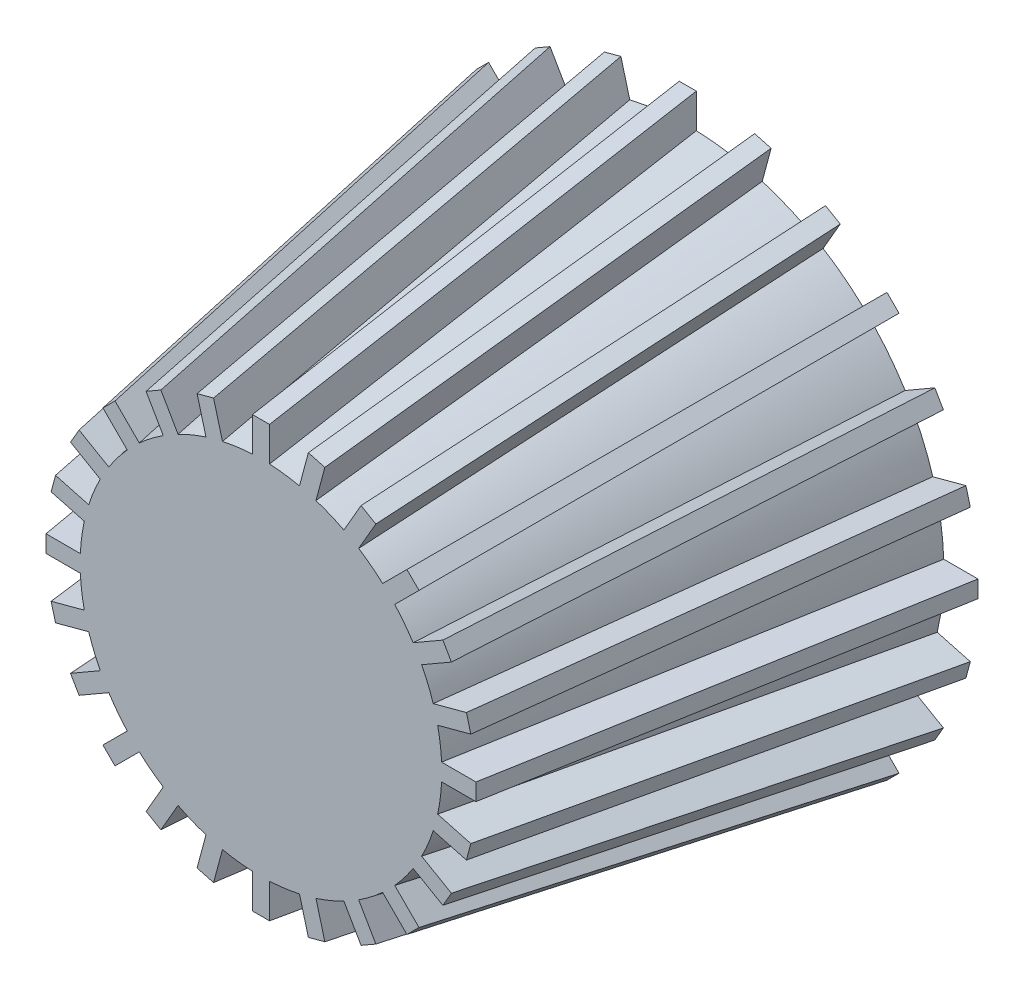
from build123d import *

# Parameters (mm, degrees)
SKETCH1_R           = 30
BOSS_EXTRUDE6_DEPTH = 50
BOSS_EXTRUDE6_TAPER = 10
SKETCH5_R           = 28
CUT_EXTRUDE1_DEPTH  = 50
CUT_EXTRUDE1_TAPER  = 10
SKETCH6_R           = 21.183650965
BOSS_EXTRUDE7_DEPTH = 5
BOSS_EXTRUDE8_DEPTH = 1
CIRPATTERN2_COUNT   = 24


with BuildPart() as part:
    # Sketch1 → Boss-Extrude6 (new body)
    with BuildSketch(Plane.XY):
        Circle(SKETCH1_R)
    extrude(amount=BOSS_EXTRUDE6_DEPTH, taper=BOSS_EXTRUDE6_TAPER)

    # Sketch5 → Cut-Extrude1 (cut)
    with BuildSketch(Plane.XY):
        Circle(SKETCH5_R)
    extrude(amount=CUT_EXTRUDE1_DEPTH, taper=CUT_EXTRUDE1_TAPER, mode=Mode.SUBTRACT)

    # Sketch6 → Boss-Extrude7 (add)
    with BuildSketch(Plane.XY.offset(50)):
        Circle(SKETCH6_R)
    extrude(amount=-BOSS_EXTRUDE7_DEPTH)

    # Sketch7 → Boss-Extrude8 (add, symmetric)
    with BuildSketch(Plane(origin=(0, 0, 0), x_dir=(0, 0, -1), z_dir=(1, 0, 0))):
        Polygon((0, 28), (-50, 19.183650965), (-50, 25.183650965), (0, 34), align=None)
    boss_extrude8 = extrude(amount=BOSS_EXTRUDE8_DEPTH, both=True)

    # CirPattern2: Boss-Extrude8 ×24 about axis
    cirpattern2_axis = Axis((0, 0, 0), (0, 0, 1))
    for i in range(1, CIRPATTERN2_COUNT):
        add(boss_extrude8.rotate(cirpattern2_axis, i * 360 / CIRPATTERN2_COUNT))


solid = part.part
